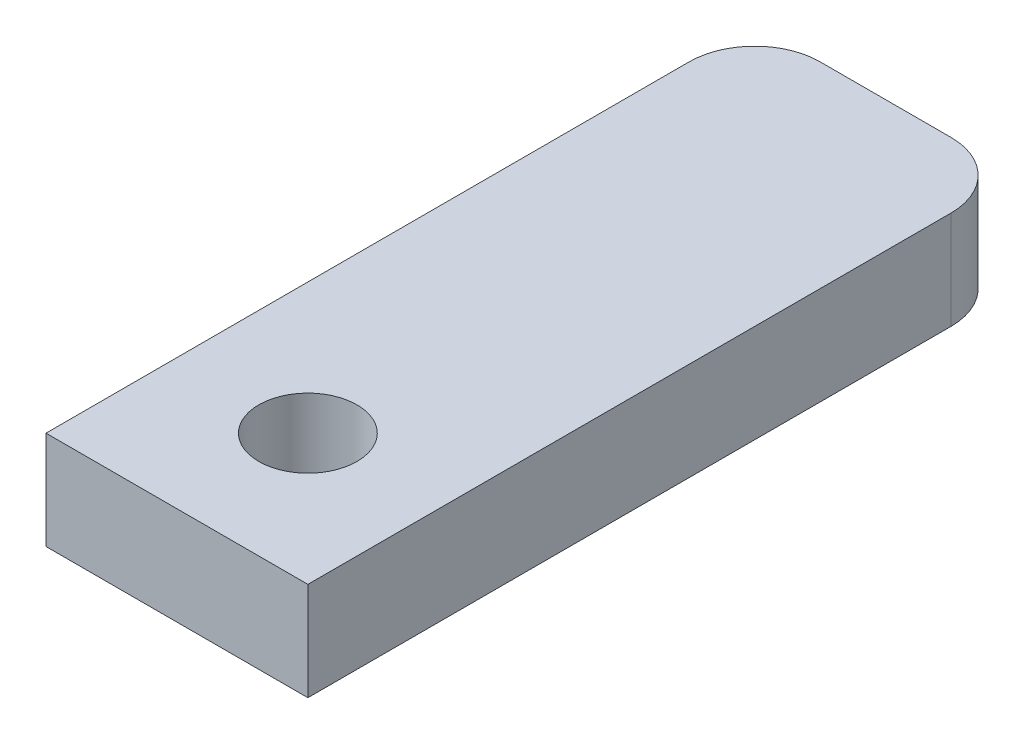
from build123d import *

# Parameters (mm, degrees)
SKETCH1_R           = 1.5
BOSS_EXTRUDE1_DEPTH = 3


with BuildPart() as part:
    # Sketch1 → Boss-Extrude1 (new body)
    with BuildSketch(Plane(origin=(0, 0, 0), x_dir=(1, 0, 0), z_dir=(0, 1, 0))):
        with BuildLine():
            Line((4, -10.823913854), (-4, -10.823913854))
            Line((-4, -10.823913854), (-4, 8.823913854))
            ThreePointArc((-4, 8.823913854), (-3.414213562, 10.238127416), (-2, 10.823913854))
            Line((-2, 10.823913854), (2, 10.823913854))
            ThreePointArc((2, 10.823913854), (3.414213562, 10.238127416), (4, 8.823913854))
            Line((4, 8.823913854), (4, -10.823913854))
        make_face()
        with Locations(Location((0, -6.823913854, 0), (0, 0, 270))):
            Circle(SKETCH1_R, mode=Mode.SUBTRACT)
    extrude(amount=BOSS_EXTRUDE1_DEPTH)


solid = part.part
